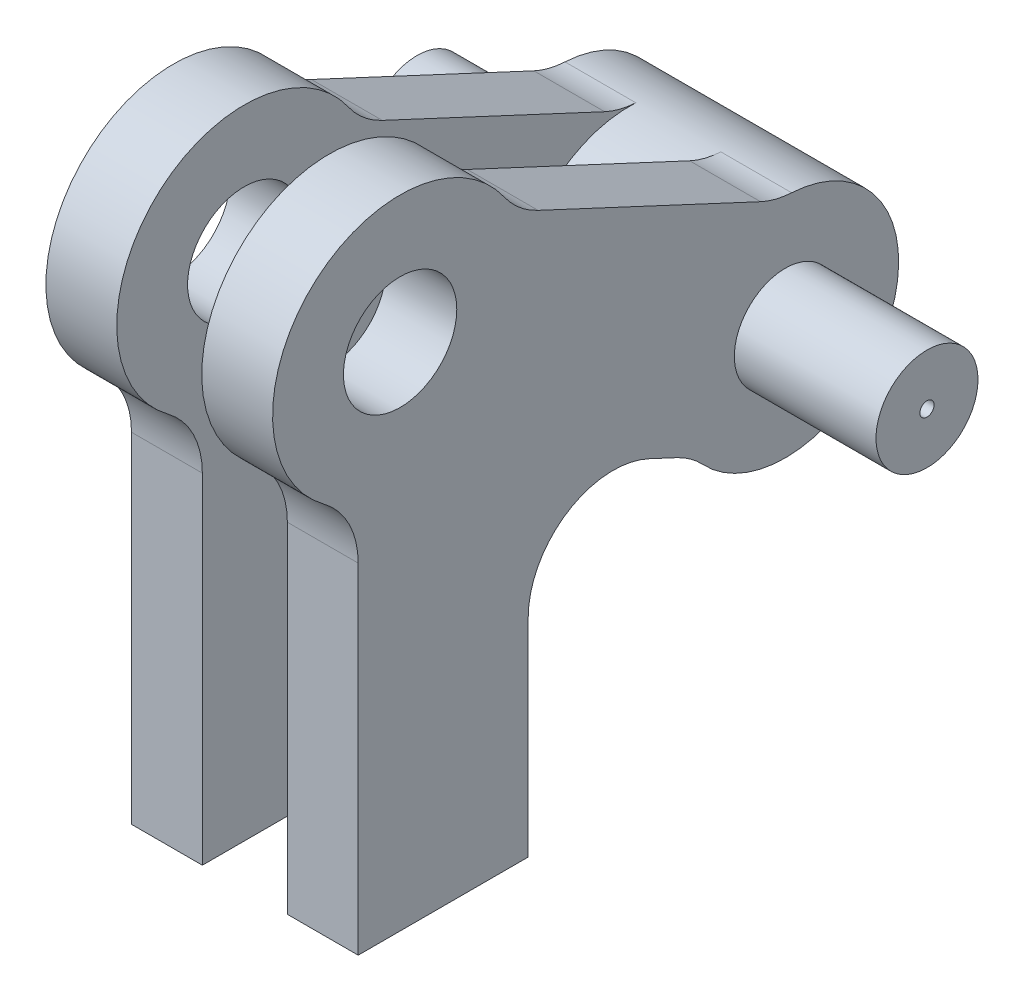
from build123d import *
from build123d.topology import SkipClean

# Parameters (mm, degrees)
EXTRUDE_1_DEPTH          = 2.5
CUT_EXTRUDE_3_DEPTH      = 26.294674154
CUT_EXTRUDE_3_DEPTH_BACK = 26.294674154
SKETCH_1_3_R             = 2
FILLET_1_R               = 3
EXTRUDE_START            = -1.5
EXTRUDE_2_DEPTH          = 1.5
EXTRUDE_5_DEPTH          = 2.5
SKETCH_2_R               = 1.8
EXTRUDE_4_DEPTH          = 5
SKETCH_3_R               = 0.25
CUT_EXTRUDE_4_DEPTH      = 2


with BuildPart() as part:
    # 草图1 → 凸台-拉伸1 (new body)
    with BuildSketch(Plane(origin=(0, 0, 0), x_dir=(0, 0, -1), z_dir=(1, 0, 0))):
        with BuildLine():
            Line((1.479163916, 3.172077255), (-1.479163916, -3.172077255))
            Line((-1.479163916, -3.172077255), (3.19185305, -3.172077255))
            ThreePointArc((3.19185305, -3.172077255), (4.160128527, -1.715613779), (4.5, 0))
            ThreePointArc((4.5, 0), (4.384156276, 1.014482011), (4.042589444, 1.9767323))
            Line((4.042589444, 1.9767323), (1.479163916, 3.172077255))
        make_face()
        with BuildLine():
            Line((1.084261612, -4.36742221), (-1.479163916, -3.172077255))
            Line((-1.479163916, -3.172077255), (-1.479163916, -4.249949895))
            ThreePointArc((-1.479163916, -4.249949895), (-0.206002169, -4.495282317), (1.084261612, -4.36742221))
        make_face()
        with BuildLine():
            Line((3.19185305, -3.172077255), (-1.479163916, -3.172077255))
            Line((-1.479163916, -3.172077255), (1.084261612, -4.36742221))
            ThreePointArc((1.084261612, -4.36742221), (2.220022869, -3.914268573), (3.19185305, -3.172077255))
        make_face()
        with BuildLine():
            Line((-1.479163916, -4.249949895), (-1.479163916, -3.172077255))
            Line((-1.479163916, -3.172077255), (1.479163916, 3.172077255))
            Line((1.479163916, 3.172077255), (4.042589444, 1.9767323))
            ThreePointArc((4.042589444, 1.9767323), (-3.366850219, 2.985685784), (-1.479163916, -4.249949895))
        make_face()
        with BuildLine():
            ThreePointArc((4.5, 0), (4.160128527, -1.715613779), (3.19185305, -3.172077255))
            Line((3.19185305, -3.172077255), (4.520836084, -3.172077255))
            Line((4.520836084, -3.172077255), (4.520836084, -5.969923204))
            Line((4.520836084, -5.969923204), (10.360395407, -8.692954436))
            ThreePointArc((10.360395407, -8.692954436), (9.969385657, -4.648800879), (13.318723239, -2.348799927))
            Line((13.318723239, -2.348799927), (4.042589444, 1.9767323))
            ThreePointArc((4.042589444, 1.9767323), (4.384156276, 1.014482011), (4.5, 0))
        make_face()
        with BuildLine():
            Line((4.520836084, -3.172077255), (3.19185305, -3.172077255))
            ThreePointArc((3.19185305, -3.172077255), (2.220022869, -3.914268573), (1.084261612, -4.36742221))
            Line((1.084261612, -4.36742221), (4.520836084, -5.969923204))
            Line((4.520836084, -5.969923204), (4.520836084, -3.172077255))
        make_face()
        with BuildLine():
            ThreePointArc((1.084261612, -4.36742221), (-0.206002169, -4.495282317), (-1.479163916, -4.249949895))
            Line((-1.479163916, -4.249949895), (-1.479163916, -18))
            Line((-1.479163916, -18), (4.520836084, -18))
            Line((4.520836084, -18), (4.520836084, -5.969923204))
            Line((4.520836084, -5.969923204), (1.084261612, -4.36742221))
        make_face()
        with BuildLine():
            ThreePointArc((17.594616806, -6.339273926), (16.323758221, -3.414930045), (13.318723239, -2.348799927))
            Line((13.318723239, -2.348799927), (15.073780722, -3.167196671))
            Line((15.073780722, -3.167196671), (12.115452889, -9.511351181))
            Line((12.115452889, -9.511351181), (10.360395407, -8.692954436))
            ThreePointArc((10.360395407, -8.692954436), (14.832177795, -10.143014558), (17.594616806, -6.339273926))
        make_face()
        with BuildLine():
            Line((15.073780722, -3.167196671), (13.318723239, -2.348799927))
            ThreePointArc((13.318723239, -2.348799927), (9.969385657, -4.648800879), (10.360395407, -8.692954436))
            Line((10.360395407, -8.692954436), (12.115452889, -9.511351181))
            Line((12.115452889, -9.511351181), (15.073780722, -3.167196671))
        make_face()
    extrude(amount=EXTRUDE_1_DEPTH)

    # 草图1<3> → 切除-拉伸3 (cut, two sides: drawn at the far end of the back side and taken through both)
    with BuildSketch(Plane(origin=(0, 0, 0), x_dir=(0, 0, -1), z_dir=(1, 0, 0)).offset(-CUT_EXTRUDE_3_DEPTH_BACK)):
        Circle(SKETCH_1_3_R)
        with Locations((13.594616806, -6.339273926)):
            Circle(SKETCH_1_3_R)
    extrude(amount=CUT_EXTRUDE_3_DEPTH + CUT_EXTRUDE_3_DEPTH_BACK, mode=Mode.SUBTRACT)

    # 圆角1
    fillet_1_edges = [part.edges().sort_by_distance(p)[0] for p in [
        (1.25, -2.348799927, -13.318723239),
        (1.25, 1.9767323, -4.042589444),
        (1.25, -8.692954436, -10.360395407),
        (1.25, -5.969923204, -4.520836084),
        (1.25, -4.249949895, 1.479163916),
    ]]
    fillet(fillet_1_edges, radius=FILLET_1_R)

    # 草图1<4> → 凸台-拉伸2 (add)
    with SkipClean():  # the faces are left unmerged after this step: merging them gives an invalid solid
        with BuildSketch(Plane(origin=(0, 0, 0), x_dir=(0, 0, -1), z_dir=(1, 0, 0)).offset(EXTRUDE_START)):
            with BuildLine():
                ThreePointArc((17.594616806, -6.339273926), (16.323758221, -3.414930045), (13.318723239, -2.348799927))
                Line((13.318723239, -2.348799927), (15.073780722, -3.167196671))
                Line((15.073780722, -3.167196671), (14.439853329, -4.526658352))
                ThreePointArc((14.439853329, -4.526658352), (15.281399697, -5.264674709), (15.594616806, -6.339273926))
                ThreePointArc((15.594616806, -6.339273926), (14.669216022, -8.026056818), (12.749380282, -8.1518895))
                Line((12.749380282, -8.1518895), (12.115452889, -9.511351181))
                Line((12.115452889, -9.511351181), (10.360395407, -8.692954436))
                ThreePointArc((10.360395407, -8.692954436), (14.832177795, -10.143014558), (17.594616806, -6.339273926))
            make_face()
            with BuildLine():
                Line((15.073780722, -3.167196671), (13.318723239, -2.348799927))
                ThreePointArc((13.318723239, -2.348799927), (9.969385657, -4.648800879), (10.360395407, -8.692954436))
                Line((10.360395407, -8.692954436), (12.115452889, -9.511351181))
                Line((12.115452889, -9.511351181), (12.749380282, -8.1518895))
                ThreePointArc((12.749380282, -8.1518895), (11.782001231, -5.494037403), (14.439853329, -4.526658352))
                Line((14.439853329, -4.526658352), (15.073780722, -3.167196671))
            make_face()
        extrude(amount=EXTRUDE_2_DEPTH)

    # 草图1<5> → 凸台-拉伸5 (add)
    with BuildSketch(Plane(origin=(0, 0, 0), x_dir=(0, 0, -1), z_dir=(1, 0, 0))):
        with BuildLine():
            ThreePointArc((15.594616806, -6.339273926), (15.281399697, -5.264674709), (14.439853329, -4.526658352))
            Line((14.439853329, -4.526658352), (12.749380282, -8.1518895))
            ThreePointArc((12.749380282, -8.1518895), (14.669216022, -8.026056818), (15.594616806, -6.339273926))
        make_face()
        with BuildLine():
            Line((12.749380282, -8.1518895), (14.439853329, -4.526658352))
            ThreePointArc((14.439853329, -4.526658352), (11.782001231, -5.494037403), (12.749380282, -8.1518895))
        make_face()
    extrude(amount=EXTRUDE_5_DEPTH)

    # 草图2 → 凸台-拉伸4 (add)
    with BuildSketch(Plane(origin=(2.5, 0, 0), x_dir=(0, 0, -1), z_dir=(1, 0, 0))):
        with Locations((13.594616806, -6.339273926)):
            Circle(SKETCH_2_R)
    extrude(amount=EXTRUDE_4_DEPTH)

    # 草图3 → 切除-拉伸4 (cut)
    with BuildSketch(Plane(origin=(7.5, 0, 0), x_dir=(0, 0, -1), z_dir=(1, 0, 0))):
        with Locations((13.594616806, -6.339273926)):
            Circle(SKETCH_3_R)
    extrude(amount=-CUT_EXTRUDE_4_DEPTH, mode=Mode.SUBTRACT)

    # 镜向1: part across plane


with BuildPart() as part_1:
    add(part.part)
    add(part.part.mirror(Plane.ZY.offset(1.5)))


solid = part_1.part
